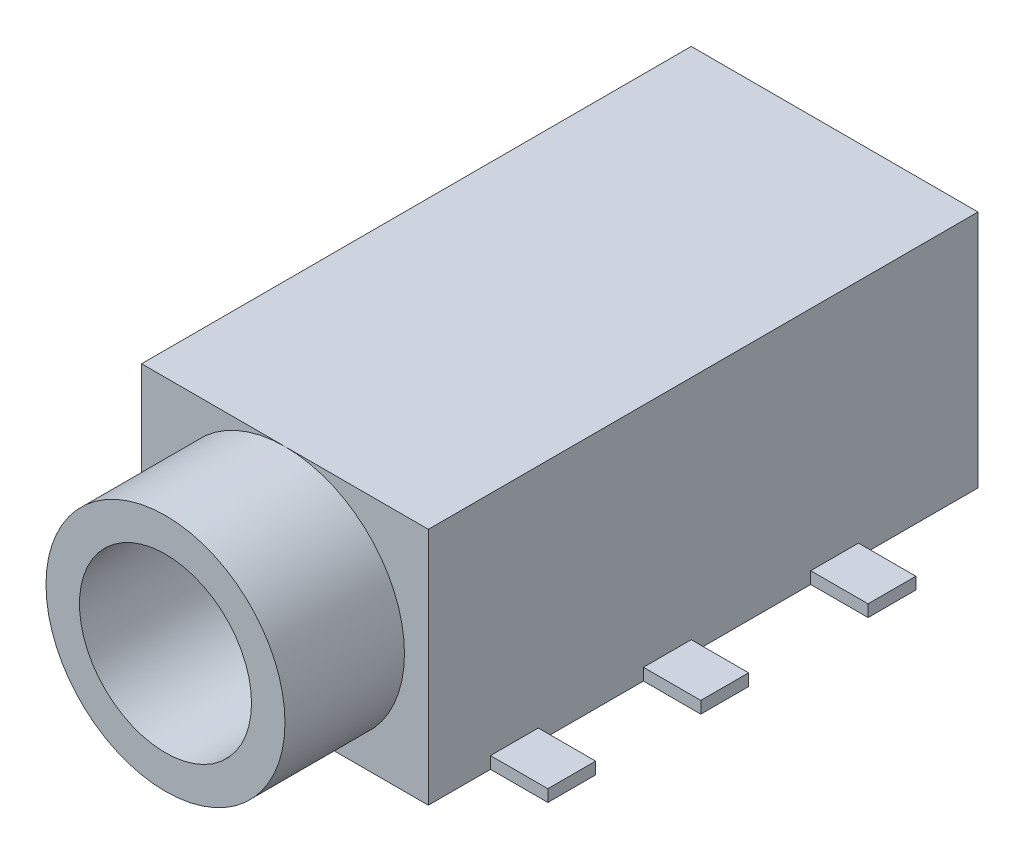
from build123d import *

# Parameters (mm, degrees)
SKETCH_1_W          = 6
SKETCH_1_H          = 11.5
EXTRUDE_1_DEPTH     = 5
SKETCH_2_R          = 2.5
EXTRUDE_2_DEPTH     = 2.5
SKETCH_3_R          = 0.75
EXTRUDE_3_DEPTH     = 0.5
SKETCH_4_W          = 1
SKETCH_4_H          = 0.25
EXTRUDE_4_DEPTH     = 1.2
SKETCH_5_R          = 1.8
CUT_EXTRUDE_1_DEPTH = 16.447977214


with BuildPart() as part:
    # 草图1 → 凸台-拉伸1 (new body)
    with BuildSketch(Plane(origin=(0, 0, 0), x_dir=(1, 0, 0), z_dir=(0, 1, 0))):
        with Locations((0, 5.75)):
            Rectangle(SKETCH_1_W, SKETCH_1_H)
    extrude(amount=EXTRUDE_1_DEPTH)

    # 草图2 → 凸台-拉伸2 (add)
    with BuildSketch(Plane.XY):
        with Locations(Location((0, 2.5, 0), (0, 0, 270))):
            Circle(SKETCH_2_R)
    extrude(amount=EXTRUDE_2_DEPTH)

    # 草图3 → 凸台-拉伸3 (add)
    with BuildSketch(Plane.XZ):
        with Locations(Location((0, -2.5, 0), (0, 0, 270))):
            Circle(SKETCH_3_R)
        with Locations(Location((0, -8.5, 0), (0, 0, 270))):
            Circle(SKETCH_3_R)
    extrude(amount=EXTRUDE_3_DEPTH)

    # 草图4 → 凸台-拉伸4 (add)
    with BuildSketch(Plane(origin=(3, 0, 0), x_dir=(0, 0, -1), z_dir=(1, 0, 0))):
        with Locations((1.8, 0.125)):
            Rectangle(SKETCH_4_W, SKETCH_4_H)
        with Locations((5, 0.125)):
            Rectangle(SKETCH_4_W, SKETCH_4_H)
        with Locations((8.5, 0.125)):
            Rectangle(SKETCH_4_W, SKETCH_4_H)
    extrude_4 = extrude(amount=EXTRUDE_4_DEPTH)

    # 镜向1: 凸台-拉伸4 across plane
    add(extrude_4.mirror(Plane(origin=(0, 0, 0), x_dir=(0, 0, 1), z_dir=(1, 0, 0))))

    # 草图5 → 切除-拉伸1 (cut, through all)
    with BuildSketch(Plane.XY.offset(2.5)):
        with Locations((0, 2.5)):
            Circle(SKETCH_5_R)
    extrude(amount=-CUT_EXTRUDE_1_DEPTH, mode=Mode.SUBTRACT)


solid = part.part
